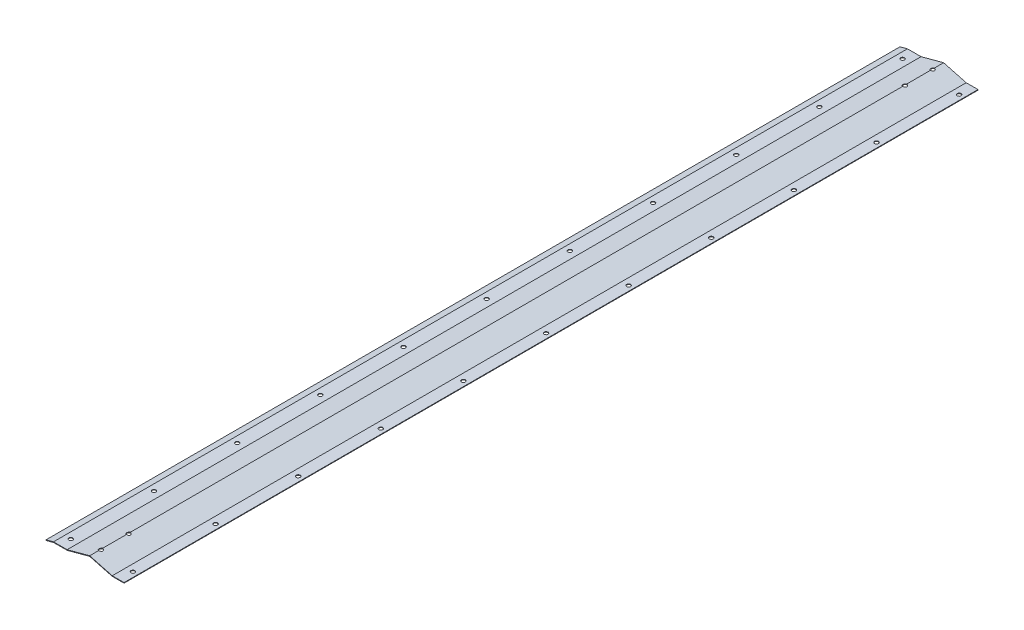
from build123d import *

# Parameters (mm, degrees)
BOSS_EXTRUDE1_DEPTH     = 1540
CUT_EXTRUDE1_DEPTH      = 47886.152097935
CUT_EXTRUDE1_DEPTH_BACK = 47886.152097935
SKETCH2_R               = 3.500000003
SKETCH2_R_2             = 3.5
SKETCH3_R               = 3.5
CUT_EXTRUDE2_DEPTH      = 47886.152097935
LPATTERN1_COUNT         = 11
LPATTERN1_PITCH         = 149
SKETCH4_R               = 3.500000003
CUT_EXTRUDE3_DEPTH      = 47886.152097935
LPATTERN2_COUNT         = 11
LPATTERN2_PITCH         = 150


with BuildPart() as part:
    # Sketch1 → Boss-Extrude1 (new body)
    with BuildSketch(Plane.XY):
        Polygon((47860.381031815, 20322.146461628), (47838.954087292, 20322.146461628), (47798.381031816, 20333.016781299), (47757.807976339, 20322.146461628), (47733.381031815, 20322.146461628), (47719.858070247, 20318.522994997), (47719.590121055, 20319.522994997), (47733.113082623, 20323.146461628), (47757.676337852, 20323.146461628), (47798.381031816, 20334.052049839), (47839.085725779, 20323.146461628), (47860.381031815, 20323.146461628), align=None)
    extrude(amount=BOSS_EXTRUDE1_DEPTH)

    # Sketch2 → Cut-Extrude1 (cut, two sides: drawn at the far end of the back side and taken through both)
    with BuildSketch(Plane(origin=(0, 20323.146461628, 0), x_dir=(1, 0, 0), z_dir=(0, 1, 0)).offset(-CUT_EXTRUDE1_DEPTH_BACK)):
        with Locations(Location((47798.381031816, -20, 0), (0, 0, 90))):
            Circle(SKETCH2_R)
        with Locations(Location((47798.381031816, -70, 0), (0, 0, 90))):
            Circle(SKETCH2_R)
        with Locations(Location((47798.381031818, -1470, 0), (0, 0, 90.000000047))):
            Circle(SKETCH2_R_2)
        with Locations(Location((47798.381031818, -1520, 0), (0, 0, 90.000000047))):
            Circle(SKETCH2_R_2)
    extrude(amount=CUT_EXTRUDE1_DEPTH + CUT_EXTRUDE1_DEPTH_BACK, mode=Mode.SUBTRACT)

    # Sketch3 → Cut-Extrude2 (cut, symmetric)
    with BuildSketch(Plane(origin=(0, 20323.146461628, 0), x_dir=(1, 0, 0), z_dir=(0, 1, 0))):
        with Locations(Location((47851.381031815, -25, 0), (0, 0, 270))):
            Circle(SKETCH3_R)
    cut_extrude2 = extrude(amount=CUT_EXTRUDE2_DEPTH, both=True, mode=Mode.SUBTRACT)

    # LPattern1: Cut-Extrude2 ×11
    with Locations(*[(0, 0, i * LPATTERN1_PITCH) for i in range(1, LPATTERN1_COUNT)]):
        add(cut_extrude2, mode=Mode.SUBTRACT)

    # Sketch4 → Cut-Extrude3 (cut, symmetric)
    with BuildSketch(Plane(origin=(0, 20323.146461628, 0), x_dir=(1, 0, 0), z_dir=(0, 1, 0))):
        with Locations(Location((47744.381031816, -1520, 0), (0, 0, 90))):
            Circle(SKETCH4_R)
    cut_extrude3 = extrude(amount=CUT_EXTRUDE3_DEPTH, both=True, mode=Mode.SUBTRACT)

    # LPattern2: Cut-Extrude3 ×11
    with Locations(*[(0, 0, -i * LPATTERN2_PITCH) for i in range(1, LPATTERN2_COUNT)]):
        add(cut_extrude3, mode=Mode.SUBTRACT)


solid = part.part
